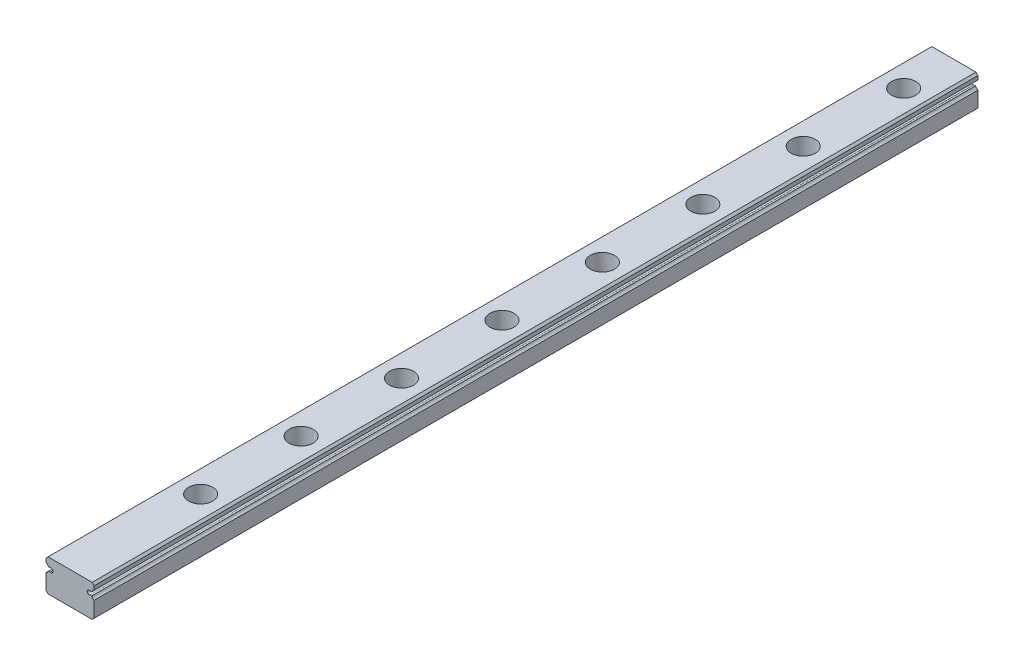
from build123d import *

# Parameters (mm, degrees)
BOSS_EXTRUDE1_DEPTH = 220
SKETCH2_R           = 3
CUT_EXTRUDE1_DEPTH  = 4.5
SKETCH3_R           = 1.75
CUT_EXTRUDE2_DEPTH  = 221.127803787
LPATTERN1_COUNT     = 8
LPATTERN1_PITCH     = 25


with BuildPart() as part:
    # Sketch1 → Boss-Extrude1 (new body)
    with BuildSketch(Plane.XY):
        with BuildLine():
            Line((6, -3.5), (6, 0.368911094))
            ThreePointArc((6, 0.368911094), (5.63354293, 0.61854293), (5.383911094, 0.985))
            Line((5.383911094, 0.985), (4.92112495, 0.985))
            ThreePointArc((4.92112495, 0.985), (4.265, 1.46), (4.92112495, 1.935))
            Line((4.92112495, 1.935), (5.383911094, 1.935))
            ThreePointArc((5.383911094, 1.935), (5.63354293, 2.30145707), (6, 2.551088906))
            Line((6, 2.551088906), (6, 3.5))
            Line((6, 3.5), (5.5, 4))
            Line((5.5, 4), (-5.5, 4))
            Line((-5.5, 4), (-6, 3.5))
            Line((-6, 3.5), (-6, 2.551088906))
            ThreePointArc((-6, 2.551088906), (-5.63354293, 2.30145707), (-5.383911094, 1.935))
            Line((-5.383911094, 1.935), (-4.92112495, 1.935))
            ThreePointArc((-4.92112495, 1.935), (-4.265, 1.46), (-4.92112495, 0.985))
            Line((-4.92112495, 0.985), (-5.383911094, 0.985))
            ThreePointArc((-5.383911094, 0.985), (-5.63354293, 0.61854293), (-6, 0.368911094))
            Line((-6, 0.368911094), (-6, -3.5))
            Line((-6, -3.5), (-5.5, -4))
            Line((-5.5, -4), (5.5, -4))
            Line((5.5, -4), (6, -3.5))
        make_face()
    extrude(amount=BOSS_EXTRUDE1_DEPTH)

    # Sketch2 → Cut-Extrude1 (cut)
    with BuildSketch(Plane(origin=(0, 4, 0), x_dir=(1, 0, 0), z_dir=(0, 1, 0))):
        with Locations(Location((0, -12.5, 0), (0, 0, 180))):
            Circle(SKETCH2_R)
    cut_extrude1 = extrude(amount=-CUT_EXTRUDE1_DEPTH, mode=Mode.SUBTRACT)

    # Sketch3 → Cut-Extrude2 (cut, through all)
    with BuildSketch(Plane(origin=(0, -0.5, 0), x_dir=(1, 0, 0), z_dir=(0, 1, 0))):
        with Locations(Location((0, -12.5, 0), (0, 0, 180))):
            Circle(SKETCH3_R)
    cut_extrude2 = extrude(amount=-CUT_EXTRUDE2_DEPTH, mode=Mode.SUBTRACT)

    # LPattern1: Cut-Extrude1, Cut-Extrude2 ×8
    with Locations(*[(0, 0, i * LPATTERN1_PITCH) for i in range(1, LPATTERN1_COUNT)]):
        add(cut_extrude1, mode=Mode.SUBTRACT)
        add(cut_extrude2, mode=Mode.SUBTRACT)


solid = part.part
